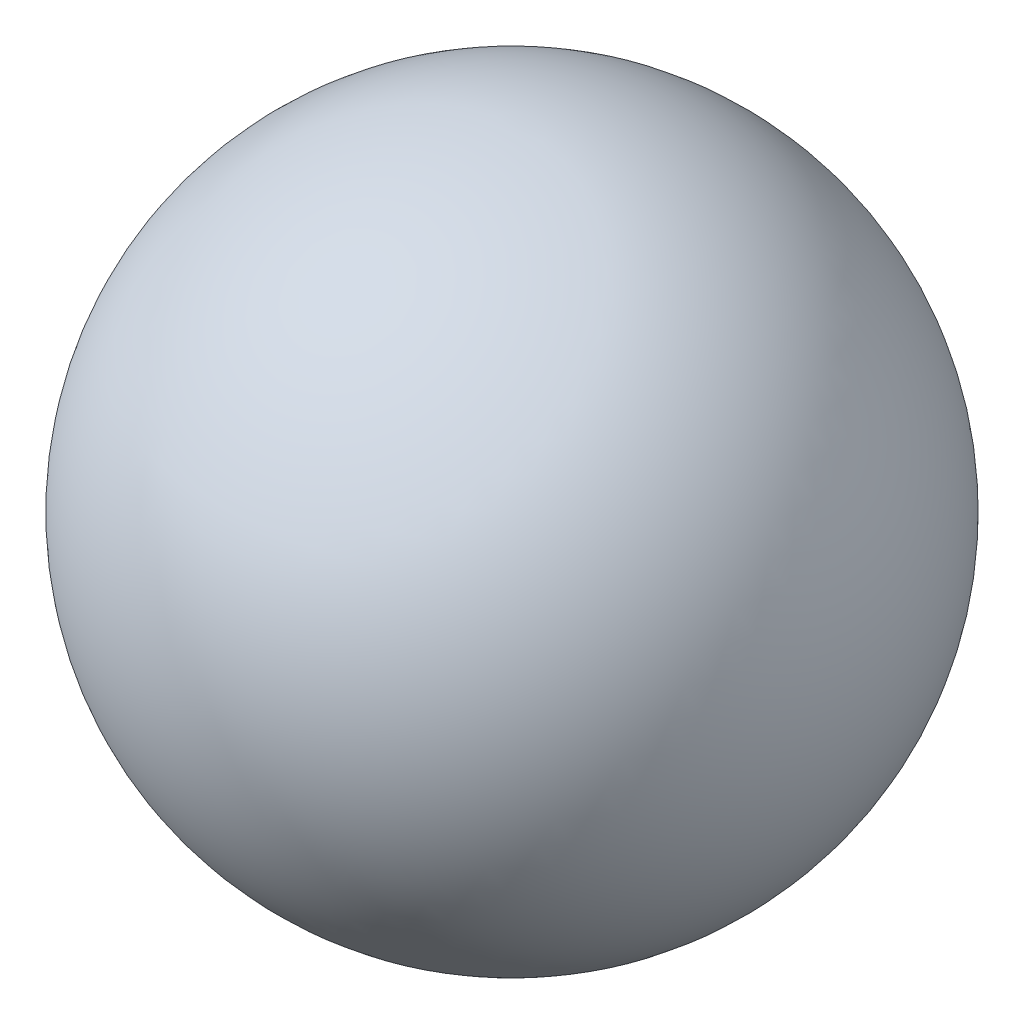
from build123d import *


with BuildPart() as part:
    # Sketch1 → Revolve1 (revolve)
    with BuildSketch(Plane.XY):
        with BuildLine():
            Line((0, 7), (0, -7))
            ThreePointArc((0, -7), (7, 0), (0, 7))
        make_face()
    revolve(axis=Axis((0, -20.530880292, 0), (0, 1, 0)))


solid = part.part
